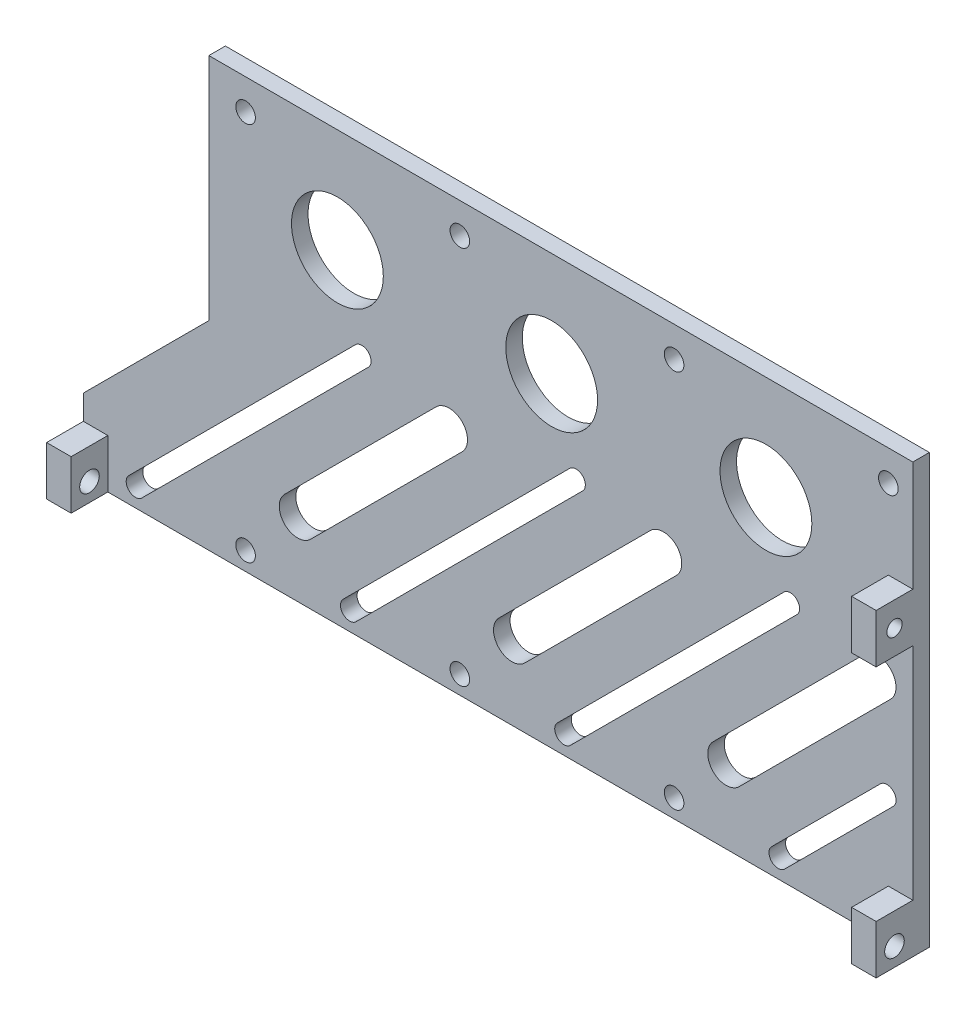
from build123d import *

# Parameters (mm, degrees)
SKETCH_1_W               = 285
SKETCH_1_H               = 70
EXTRUDE_1_DEPTH          = 2.7
SKETCH_2_R               = 1.6
SKETCH_2_R_2             = 7.5
CUT_EXTRUDE_1_DEPTH      = 147.760144453
PATTERN_LINEAR_1_COUNT   = 8
PATTERN_LINEAR_1_PITCH   = 35
SKETCH_5_W               = 4
SKETCH_5_H               = 8
SKETCH_5_W_2             = 8
EXTRUDE_3_DEPTH          = 6
CUT_EXTRUDE_3_DEPTH      = 284.304941715
CUT_EXTRUDE_3_DEPTH_BACK = 284.304941715
SKETCH_7_R               = 1.6
SKETCH_7_R_2             = 1.25
SKETCH_9_R               = 3
EXTRUDE_4_DEPTH          = 2.7
CUT_EXTRUDE_4_DEPTH      = 147.857924539
PATTERN_LINEAR_2_COUNT   = 7
PATTERN_LINEAR_2_PITCH   = 35
PATTERN_LINEAR_3_COUNT   = 2
PATTERN_LINEAR_3_PITCH   = 35
CUT_EXTRUDE_2_DEPTH      = 147.857924539
CUT_EXTRUDE_2_DEPTH_BACK = 147.857924539


with BuildPart() as part:
    # 草图1 → 凸台-拉伸1 (new body)
    with BuildSketch(Plane.XY):
        Rectangle(SKETCH_1_W, SKETCH_1_H)
    extrude(amount=EXTRUDE_1_DEPTH)

    # 草图2 → 切除-拉伸1 (cut, through all)
    with BuildSketch(Plane.XY.offset(2.7)):
        with Locations((-106.5, -32)):
            Circle(SKETCH_2_R)
        with Locations((-106.5, 30)):
            Circle(SKETCH_2_R)
        with Locations((-126.5, 18)):
            Circle(SKETCH_2_R_2)
        with BuildLine():
            Line((-125.560660172, -30.939339828), (-88.560660172, 6.060660172))
            ThreePointArc((-88.560660172, 6.060660172), (-86.439339828, 6.060660172), (-86.439339828, 3.939339828))
            Line((-86.439339828, 3.939339828), (-123.439339828, -33.060660172))
            ThreePointArc((-123.439339828, -33.060660172), (-125.560660172, -33.060660172), (-125.560660172, -30.939339828))
        make_face()
    cut_extrude_1 = extrude(amount=-CUT_EXTRUDE_1_DEPTH, mode=Mode.SUBTRACT)

    # 阵列(线性)1: 切除-拉伸1 ×8
    with Locations(*[(i * PATTERN_LINEAR_1_PITCH, 0, 0) for i in range(1, PATTERN_LINEAR_1_COUNT)]):
        add(cut_extrude_1, mode=Mode.SUBTRACT)

    # 草图5 → 凸台-拉伸3 (add)
    with BuildSketch(Plane.XY.offset(2.7)):
        with Locations((-140.5, -31)):
            Rectangle(SKETCH_5_W, SKETCH_5_H)
        with Locations((140.5, -31)):
            Rectangle(SKETCH_5_W, SKETCH_5_H)
        with Locations((7, -31)):
            Rectangle(SKETCH_5_W_2, SKETCH_5_H)
        with Locations((-140.5, 13)):
            Rectangle(SKETCH_5_W, SKETCH_5_H)
        with Locations((140.5, 13)):
            Rectangle(SKETCH_5_W, SKETCH_5_H)
        with Locations((-4, 13)):
            Rectangle(SKETCH_5_W, SKETCH_5_H)
    extrude(amount=EXTRUDE_3_DEPTH)

    # 草图7 → 切除-拉伸3 (cut, two sides: drawn at the far end of the back side and taken through both)
    with BuildSketch(Plane(origin=(-138.5, 0, 0), x_dir=(0, 0, -1), z_dir=(1, 0, 0)).offset(-CUT_EXTRUDE_3_DEPTH_BACK)):
        with Locations(Location((-5.7, -32, 0), (0, 0, 270))):
            Circle(SKETCH_7_R)
        with Locations(Location((-5.7, 13, 0), (0, 0, 270))):
            Circle(SKETCH_7_R_2)
    extrude(amount=CUT_EXTRUDE_3_DEPTH + CUT_EXTRUDE_3_DEPTH_BACK, mode=Mode.SUBTRACT)

    # 草图9 → 凸台-拉伸4 (add)
    with BuildSketch(Plane.XY.offset(2.7)):
        with Locations((138.5, -32)):
            Circle(SKETCH_9_R)
        with BuildLine():
            Line((137.196699141, -13.181980515), (142.5, -7.878679656))
            Line((142.5, -7.878679656), (142.5, -12.121320344))
            Line((142.5, -12.121320344), (139.318019485, -15.303300859))
            ThreePointArc((139.318019485, -15.303300859), (139.318019485, -13.181980515), (137.196699141, -13.181980515))
        make_face()
    extrude(amount=-EXTRUDE_4_DEPTH)

    # 草图10 → 切除-拉伸4 (cut, through all)
    with BuildSketch(Plane.XY.offset(2.7)):
        with BuildLine():
            Line((-100.121320344, -20.878679656), (-75.372583002, 3.870057685))
            ThreePointArc((-75.372583002, 3.870057685), (-71.129942315, 3.870057685), (-71.129942315, -0.372583002))
            Line((-71.129942315, -0.372583002), (-95.878679656, -25.121320344))
            ThreePointArc((-95.878679656, -25.121320344), (-100.121320344, -25.121320344), (-100.121320344, -20.878679656))
        make_face()
    cut_extrude_4 = extrude(amount=-CUT_EXTRUDE_4_DEPTH, mode=Mode.SUBTRACT)

    # 阵列(线性)2: 切除-拉伸4 ×7, 1 skipped
    with Locations(*[(i * PATTERN_LINEAR_2_PITCH, 0, 0) for i in range(1, PATTERN_LINEAR_2_COUNT) if i not in (3,)]):
        add(cut_extrude_4, mode=Mode.SUBTRACT)

    # 阵列(线性)3: 切除-拉伸4 ×2
    with Locations(*[(-i * PATTERN_LINEAR_3_PITCH, 0, 0) for i in range(1, PATTERN_LINEAR_3_COUNT)]):
        add(cut_extrude_4, mode=Mode.SUBTRACT)

    # 草图3 → 切除-拉伸2 (cut, two sides: drawn at the far end of the back side and taken through both)
    with BuildSketch(Plane.XY.offset(2.7).offset(-CUT_EXTRUDE_2_DEPTH_BACK)):
        Polygon((27.5, 35), (-142.5, 35), (-142.5, -35), (7, -35), (7, -23), (27.5, -2.5), align=None)
    extrude(amount=CUT_EXTRUDE_2_DEPTH + CUT_EXTRUDE_2_DEPTH_BACK, mode=Mode.SUBTRACT)


solid = part.part
